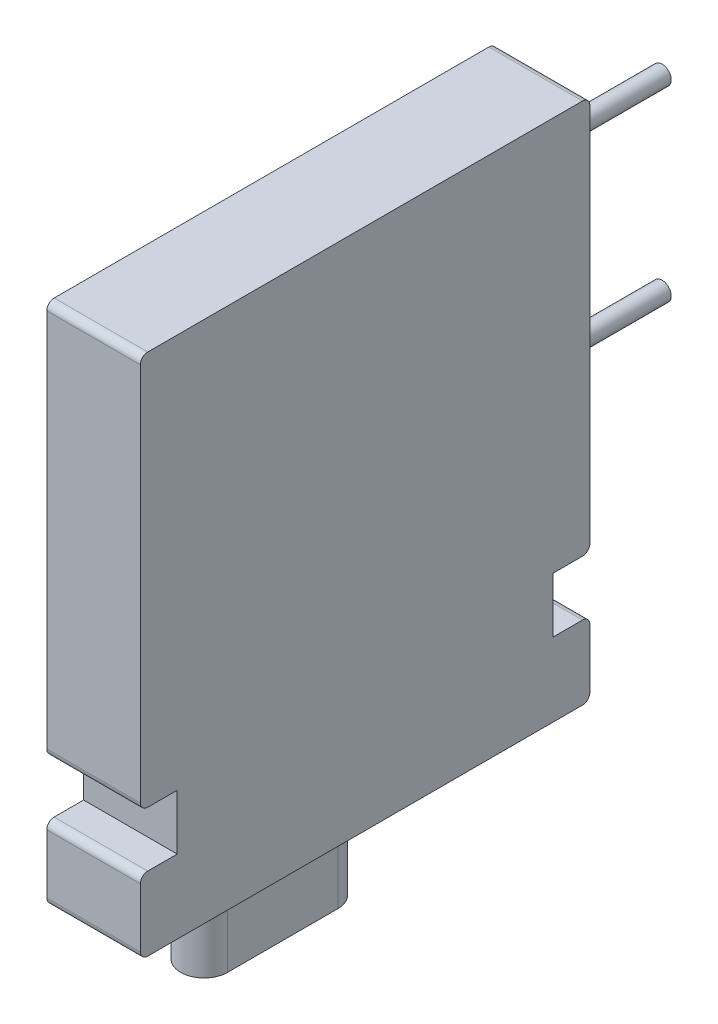
from build123d import *

# Parameters (mm, degrees)
SKETCH_1_W          = 2.54
SKETCH_1_H          = 14.2
EXTRUDE_1_DEPTH     = 12.2
SKETCH_2_R          = 0.25
EXTRUDE_2_DEPTH     = 3
EXTRUDE_3_DEPTH     = 2.1
SKETCH_4_W          = 2
SKETCH_4_H          = 2
CUT_EXTRUDE_1_DEPTH = 5
CUT_EXTRUDE_2_REACH = 20.893
SKETCH_5_W          = 2.597491907
SKETCH_5_H          = 1.5
SKETCH_5_W_2        = 2.655260115
FILLET_1_R          = 0.2


with BuildPart() as part:
    # 草图1 → 凸台-拉伸1 (new body)
    with BuildSketch(Plane.XY):
        with Locations((1.27, 7.1)):
            Rectangle(SKETCH_1_W, SKETCH_1_H)
    extrude(amount=EXTRUDE_1_DEPTH)

    # 草图2 → 凸台-拉伸2 (add)
    with BuildSketch(Plane(origin=(0, 0, 0), x_dir=(-1, 0, 0), z_dir=(0, 0, -1))):
        with Locations((-1.5, 12.7)):
            Circle(SKETCH_2_R)
        with Locations((-1.5, 7.62)):
            Circle(SKETCH_2_R)
    extrude(amount=EXTRUDE_2_DEPTH)

    # 草图3 → 凸台-拉伸3 (add)
    with BuildSketch(Plane(origin=(0, 0, 0), x_dir=(-1, 0, 0), z_dir=(0, -1, 0))):
        with BuildLine():
            Line((-1.905, -9.2), (-1.905, -6.2))
            ThreePointArc((-1.905, -6.2), (-1.27, -5.565), (-0.635, -6.2))
            Line((-0.635, -6.2), (-0.635, -9.2))
            ThreePointArc((-0.635, -9.2), (-1.27, -9.835), (-1.905, -9.2))
        make_face()
    extrude(amount=EXTRUDE_3_DEPTH)

    # 草图4 → 切除-拉伸1 (cut)
    with BuildSketch(Plane.XZ):
        with Locations((1.27, 2.5)):
            Rectangle(SKETCH_4_W, SKETCH_4_H)
    extrude(amount=-CUT_EXTRUDE_1_DEPTH, mode=Mode.SUBTRACT)

    # 草图5 → 切除-拉伸2 (cut, up to next)
    with BuildSketch(Plane(origin=(2.54, 0, 0), x_dir=(0, 0, -1), z_dir=(1, 0, 0)), mode=Mode.PRIVATE) as cut_extrude_2_sk1:
        with Locations((-12.498745954, 2.75)):
            Rectangle(SKETCH_5_W, SKETCH_5_H)
    cut_extrude_2_tool1 = extrude(cut_extrude_2_sk1.sketch, amount=-CUT_EXTRUDE_2_REACH, mode=Mode.PRIVATE) & part.part
    # 草图5 → 切除-拉伸2 (cut, up to next)
    with BuildSketch(Plane(origin=(2.54, 0, 0), x_dir=(0, 0, -1), z_dir=(1, 0, 0)), mode=Mode.PRIVATE) as cut_extrude_2_sk2:
        with Locations((0.327630058, 2.75)):
            Rectangle(SKETCH_5_W_2, SKETCH_5_H)
    cut_extrude_2_tool2 = extrude(cut_extrude_2_sk2.sketch, amount=-CUT_EXTRUDE_2_REACH, mode=Mode.PRIVATE) & part.part
    add(cut_extrude_2_tool1.solids().sort_by_distance((2.54, 2.75, 12.498746))[0], mode=Mode.SUBTRACT)
    add(cut_extrude_2_tool2.solids().sort_by_distance((2.54, 2.75, -0.32763))[0], mode=Mode.SUBTRACT)

    # 圆角1
    fillet_1_edges = [part.edges().sort_by_distance(p)[0] for p in [
        (1.27, 14.2, 12.2),
        (1.27, 14.2, 0),
        (1.27, 0, 0),
        (1.27, 3.5, 12.2),
        (1.27, 2, 12.2),
        (1.27, 3.5, 0),
        (1.27, 2, 0),
        (1.27, 0, 12.2),
    ]]
    fillet(fillet_1_edges, radius=FILLET_1_R)


solid = part.part
